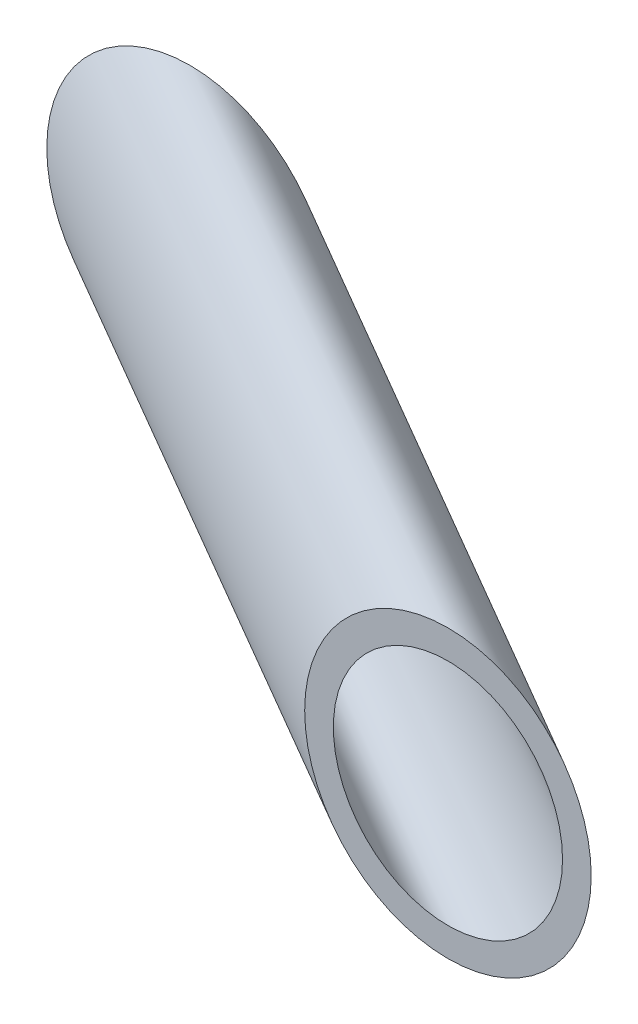
from build123d import *

# Parameters (mm, degrees)
SKETCH1_R   = 12.7
SKETCH1_R_2 = 10.16


with BuildPart() as part:
    # Sweep1: sweep along a path in Sketch2
    with BuildLine(Plane(origin=(0, 0, 0), x_dir=(1, 0, 0), z_dir=(0, 1, 0))) as sweep1_path:
        Line((0, 0), (54.61, -31.75))
    # Sketch1 → Sweep1 (sweep)
    with BuildSketch(Plane.XY):
        Circle(SKETCH1_R)
        Circle(SKETCH1_R_2, mode=Mode.SUBTRACT)
    sweep(path=sweep1_path.line)


solid = part.part
